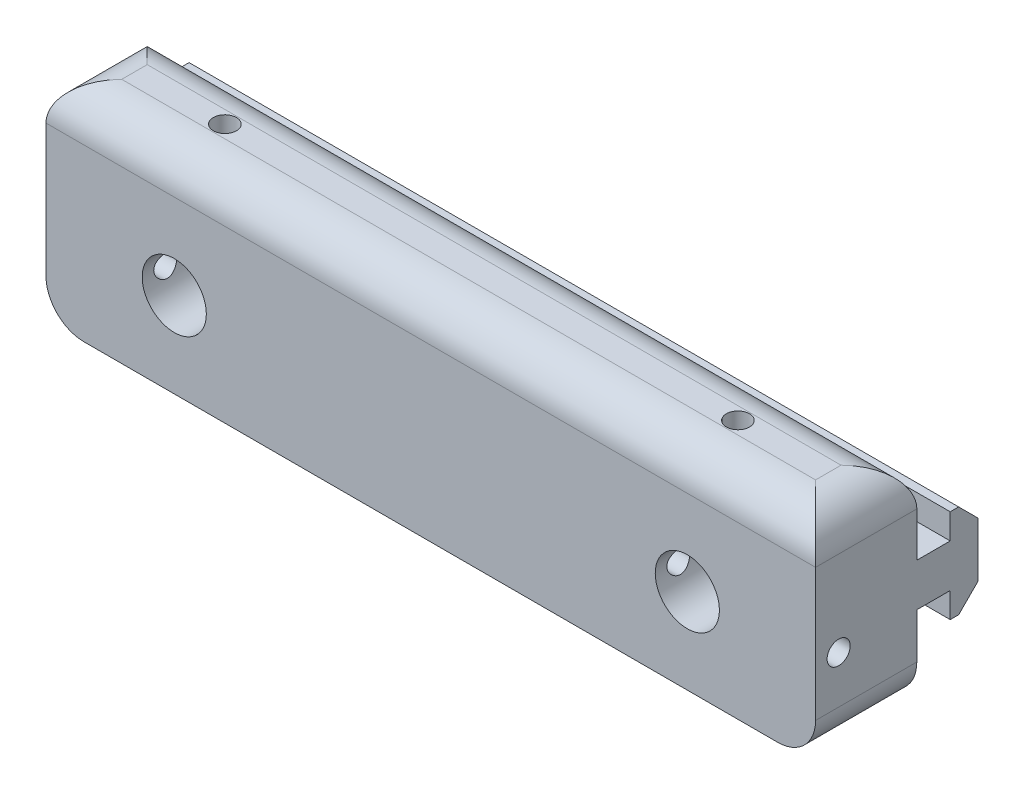
from build123d import *

# Parameters (mm, degrees)
BOSS_EXTRUDE2_DEPTH = 152.4
CUT_EXTRUDE1_DEPTH  = 25.4
FILLET1_R           = 7.5
SKETCH4_R           = 2.286
CUT_EXTRUDE2_DEPTH  = 48.26
SKETCH5_R           = 6.35
CUT_EXTRUDE3_DEPTH  = 12.7
SKETCH7_R           = 2.286
CUT_EXTRUDE4_DEPTH  = 50.8
CUT_EXTRUDE5_START  = -50.8
SKETCH8_R           = 2.286
CUT_EXTRUDE5_DEPTH  = 50.8


with BuildPart() as part:
    # Sketch2 → Boss-Extrude2 (new body)
    with BuildSketch(Plane(origin=(0, 0, 0), x_dir=(0, 0, -1), z_dir=(1, 0, 0))):
        Polygon((-14.38168799, 3.616994595), (-21, 3.616994595), (-21, 19.916342715), (-41.04895965, 19.916342715), (-41.04895965, -21.33863134), (-21, -21.33863134), (-21, -4.883005405), (-14.38168799, -4.883005405), (-14.38168799, -9.883005405), (-12.710115115, -9.883005405), (-8.88168799, -6.05457828), (-8.88168799, 4.78856747), (-12.710115115, 8.616994595), (-14.38168799, 8.616994595), align=None)
    extrude(amount=BOSS_EXTRUDE2_DEPTH)

    # Sketch3 → Cut-Extrude1 (cut)
    with BuildSketch(Plane.XZ.offset(21.33863134)):
        with BuildLine():
            ThreePointArc((57, 38.968587884), (55.939339828, 38.529248055), (55.5, 37.468587884))
            Line((55.5, 37.468587884), (55.5, 32.968587884))
            ThreePointArc((55.5, 32.968587884), (55.734314575, 32.402902459), (56.3, 32.168587884))
            Line((56.3, 32.168587884), (57.6, 32.168587884))
            Line((57.6, 32.168587884), (57.6, 33.318587884))
            Line((57.6, 33.318587884), (59.492893219, 33.318587884))
            Line((59.492893219, 33.318587884), (60.2, 32.611481102))
            Line((60.2, 32.611481102), (60.2, 31.35422853))
            Line((60.2, 31.35422853), (60.422649731, 30.968587884))
            Line((60.422649731, 30.968587884), (60.2, 30.582947238))
            Line((60.2, 30.582947238), (60.2, 29.325694665))
            Line((60.2, 29.325694665), (59.492893219, 28.618587884))
            Line((59.492893219, 28.618587884), (57.6, 28.618587884))
            Line((57.6, 28.618587884), (57.6, 29.768587884))
            Line((57.6, 29.768587884), (56.3, 29.768587884))
            ThreePointArc((56.3, 29.768587884), (55.734314575, 29.534273309), (55.5, 28.968587884))
            Line((55.5, 28.968587884), (55.5, 24.468587884))
            ThreePointArc((55.5, 24.468587884), (55.939339828, 23.407927712), (57, 22.968587884))
            Line((57, 22.968587884), (61.5, 22.968587884))
            ThreePointArc((61.5, 22.968587884), (62.065685425, 23.202902459), (62.3, 23.768587884))
            Line((62.3, 23.768587884), (62.3, 25.068587884))
            Line((62.3, 25.068587884), (61.15, 25.068587884))
            Line((61.15, 25.068587884), (61.15, 26.961481102))
            Line((61.15, 26.961481102), (61.857106781, 27.668587884))
            Line((61.857106781, 27.668587884), (63.114359354, 27.668587884))
            Line((63.114359354, 27.668587884), (63.5, 27.891237614))
            Line((63.5, 27.891237614), (63.885640646, 27.668587884))
            Line((63.885640646, 27.668587884), (65.142893219, 27.668587884))
            Line((65.142893219, 27.668587884), (65.85, 26.961481102))
            Line((65.85, 26.961481102), (65.85, 25.068587884))
            Line((65.85, 25.068587884), (64.7, 25.068587884))
            Line((64.7, 25.068587884), (64.7, 23.768587884))
            ThreePointArc((64.7, 23.768587884), (64.934314575, 23.202902459), (65.5, 22.968587884))
            Line((65.5, 22.968587884), (70, 22.968587884))
            ThreePointArc((70, 22.968587884), (71.060660172, 23.407927712), (71.5, 24.468587884))
            Line((71.5, 24.468587884), (71.5, 28.968587884))
            ThreePointArc((71.5, 28.968587884), (71.265685425, 29.534273309), (70.7, 29.768587884))
            Line((70.7, 29.768587884), (69.4, 29.768587884))
            Line((69.4, 29.768587884), (69.4, 28.618587884))
            Line((69.4, 28.618587884), (67.507106781, 28.618587884))
            Line((67.507106781, 28.618587884), (66.8, 29.325694665))
            Line((66.8, 29.325694665), (66.8, 30.582947238))
            Line((66.8, 30.582947238), (66.577350269, 30.968587884))
            Line((66.577350269, 30.968587884), (66.8, 31.35422853))
            Line((66.8, 31.35422853), (66.8, 32.611481102))
            Line((66.8, 32.611481102), (67.507106781, 33.318587884))
            Line((67.507106781, 33.318587884), (69.4, 33.318587884))
            Line((69.4, 33.318587884), (69.4, 32.168587884))
            Line((69.4, 32.168587884), (70.7, 32.168587884))
            ThreePointArc((70.7, 32.168587884), (71.265685425, 32.402902459), (71.5, 32.968587884))
            Line((71.5, 32.968587884), (71.5, 37.468587884))
            ThreePointArc((71.5, 37.468587884), (71.060660172, 38.529248055), (70, 38.968587884))
            Line((70, 38.968587884), (65.5, 38.968587884))
            ThreePointArc((65.5, 38.968587884), (64.934314575, 38.734273309), (64.7, 38.168587884))
            Line((64.7, 38.168587884), (64.7, 36.868587884))
            Line((64.7, 36.868587884), (65.85, 36.868587884))
            Line((65.85, 36.868587884), (65.85, 34.975694665))
            Line((65.85, 34.975694665), (65.142893219, 34.268587884))
            Line((65.142893219, 34.268587884), (63.885640646, 34.268587884))
            Line((63.885640646, 34.268587884), (63.5, 34.045938153))
            Line((63.5, 34.045938153), (63.114359354, 34.268587884))
            Line((63.114359354, 34.268587884), (61.857106781, 34.268587884))
            Line((61.857106781, 34.268587884), (61.15, 34.975694665))
            Line((61.15, 34.975694665), (61.15, 36.868587884))
            Line((61.15, 36.868587884), (62.3, 36.868587884))
            Line((62.3, 36.868587884), (62.3, 38.168587884))
            ThreePointArc((62.3, 38.168587884), (62.065685425, 38.734273309), (61.5, 38.968587884))
            Line((61.5, 38.968587884), (57, 38.968587884))
        make_face()
        with BuildLine():
            Line((95.4, 38.968587884), (90.9, 38.968587884))
            ThreePointArc((90.9, 38.968587884), (90.334314575, 38.734273309), (90.1, 38.168587884))
            Line((90.1, 38.168587884), (90.1, 36.868587884))
            Line((90.1, 36.868587884), (91.25, 36.868587884))
            Line((91.25, 36.868587884), (91.25, 34.975694665))
            Line((91.25, 34.975694665), (90.542893219, 34.268587884))
            Line((90.542893219, 34.268587884), (89.285640646, 34.268587884))
            Line((89.285640646, 34.268587884), (88.9, 34.045938153))
            Line((88.9, 34.045938153), (88.514359354, 34.268587884))
            Line((88.514359354, 34.268587884), (87.257106781, 34.268587884))
            Line((87.257106781, 34.268587884), (86.55, 34.975694665))
            Line((86.55, 34.975694665), (86.55, 36.868587884))
            Line((86.55, 36.868587884), (87.7, 36.868587884))
            Line((87.7, 36.868587884), (87.7, 38.168587884))
            ThreePointArc((87.7, 38.168587884), (87.465685425, 38.734273309), (86.9, 38.968587884))
            Line((86.9, 38.968587884), (82.4, 38.968587884))
            ThreePointArc((82.4, 38.968587884), (81.339339828, 38.529248055), (80.9, 37.468587884))
            Line((80.9, 37.468587884), (80.9, 32.968587884))
            ThreePointArc((80.9, 32.968587884), (81.134314575, 32.402902459), (81.7, 32.168587884))
            Line((81.7, 32.168587884), (83, 32.168587884))
            Line((83, 32.168587884), (83, 33.318587884))
            Line((83, 33.318587884), (84.892893219, 33.318587884))
            Line((84.892893219, 33.318587884), (85.6, 32.611481102))
            Line((85.6, 32.611481102), (85.6, 31.35422853))
            Line((85.6, 31.35422853), (85.822649731, 30.968587884))
            Line((85.822649731, 30.968587884), (85.6, 30.582947238))
            Line((85.6, 30.582947238), (85.6, 29.325694665))
            Line((85.6, 29.325694665), (84.892893219, 28.618587884))
            Line((84.892893219, 28.618587884), (83, 28.618587884))
            Line((83, 28.618587884), (83, 29.768587884))
            Line((83, 29.768587884), (81.7, 29.768587884))
            ThreePointArc((81.7, 29.768587884), (81.134314575, 29.534273309), (80.9, 28.968587884))
            Line((80.9, 28.968587884), (80.9, 24.468587884))
            ThreePointArc((80.9, 24.468587884), (81.339339828, 23.407927712), (82.4, 22.968587884))
            Line((82.4, 22.968587884), (86.9, 22.968587884))
            ThreePointArc((86.9, 22.968587884), (87.465685425, 23.202902459), (87.7, 23.768587884))
            Line((87.7, 23.768587884), (87.7, 25.068587884))
            Line((87.7, 25.068587884), (86.55, 25.068587884))
            Line((86.55, 25.068587884), (86.55, 26.961481102))
            Line((86.55, 26.961481102), (87.257106781, 27.668587884))
            Line((87.257106781, 27.668587884), (88.514359354, 27.668587884))
            Line((88.514359354, 27.668587884), (88.9, 27.891237614))
            Line((88.9, 27.891237614), (89.285640646, 27.668587884))
            Line((89.285640646, 27.668587884), (90.542893219, 27.668587884))
            Line((90.542893219, 27.668587884), (91.25, 26.961481102))
            Line((91.25, 26.961481102), (91.25, 25.068587884))
            Line((91.25, 25.068587884), (90.1, 25.068587884))
            Line((90.1, 25.068587884), (90.1, 23.768587884))
            ThreePointArc((90.1, 23.768587884), (90.334314575, 23.202902459), (90.9, 22.968587884))
            Line((90.9, 22.968587884), (95.4, 22.968587884))
            ThreePointArc((95.4, 22.968587884), (96.460660172, 23.407927712), (96.9, 24.468587884))
            Line((96.9, 24.468587884), (96.9, 28.968587884))
            ThreePointArc((96.9, 28.968587884), (96.665685425, 29.534273309), (96.1, 29.768587884))
            Line((96.1, 29.768587884), (94.8, 29.768587884))
            Line((94.8, 29.768587884), (94.8, 28.618587884))
            Line((94.8, 28.618587884), (92.907106781, 28.618587884))
            Line((92.907106781, 28.618587884), (92.2, 29.325694665))
            Line((92.2, 29.325694665), (92.2, 30.582947238))
            Line((92.2, 30.582947238), (91.977350269, 30.968587884))
            Line((91.977350269, 30.968587884), (92.2, 31.35422853))
            Line((92.2, 31.35422853), (92.2, 32.611481102))
            Line((92.2, 32.611481102), (92.907106781, 33.318587884))
            Line((92.907106781, 33.318587884), (94.8, 33.318587884))
            Line((94.8, 33.318587884), (94.8, 32.168587884))
            Line((94.8, 32.168587884), (96.1, 32.168587884))
            ThreePointArc((96.1, 32.168587884), (96.665685425, 32.402902459), (96.9, 32.968587884))
            Line((96.9, 32.968587884), (96.9, 37.468587884))
            ThreePointArc((96.9, 37.468587884), (96.460660172, 38.529248055), (95.4, 38.968587884))
        make_face()
    extrude(amount=-CUT_EXTRUDE1_DEPTH, mode=Mode.SUBTRACT)

    # Fillet1
    fillet1_edges = [part.edges().sort_by_distance(p)[0] for p in [
        (0, -21.33863134, 31.024479825),
        (152.4, -21.33863134, 31.024479825),
        (152.4, 19.916342715, 31.024479825),
        (76.2, 19.916342715, 41.04895965),
        (0, 19.916342715, 31.024479825),
        (76.2, 19.916342715, 21),
    ]]
    fillet(fillet1_edges, radius=FILLET1_R)

    # Sketch4 → Cut-Extrude2 (cut)
    with BuildSketch(Plane.XZ.offset(21.33863134)):
        with Locations((25.4, 31.024479825)):
            Circle(SKETCH4_R)
        with Locations((127, 31.024479825)):
            Circle(SKETCH4_R)
    extrude(amount=-CUT_EXTRUDE2_DEPTH, mode=Mode.SUBTRACT)

    # Sketch5 → Cut-Extrude3 (cut)
    with BuildSketch(Plane.XY.offset(41.04895965)):
        with Locations((25.4, -4.461144313)):
            Circle(SKETCH5_R)
        with Locations((127, -4.461144313)):
            Circle(SKETCH5_R)
    extrude(amount=-CUT_EXTRUDE3_DEPTH, mode=Mode.SUBTRACT)

    # Sketch7 → Cut-Extrude4 (cut)
    with BuildSketch(Plane.ZY):
        with Locations((36.47695965, -4.461144394)):
            Circle(SKETCH7_R)
    extrude(amount=-CUT_EXTRUDE4_DEPTH, mode=Mode.SUBTRACT)

    # Sketch8 → Cut-Extrude5 (cut)
    with BuildSketch(Plane(origin=(152.4, 0, 0), x_dir=(0, 0, -1), z_dir=(1, 0, 0)).offset(CUT_EXTRUDE5_START)):
        with Locations((-36.476958724, -4.461144394)):
            Circle(SKETCH8_R)
    extrude(amount=CUT_EXTRUDE5_DEPTH, mode=Mode.SUBTRACT)


solid = part.part
